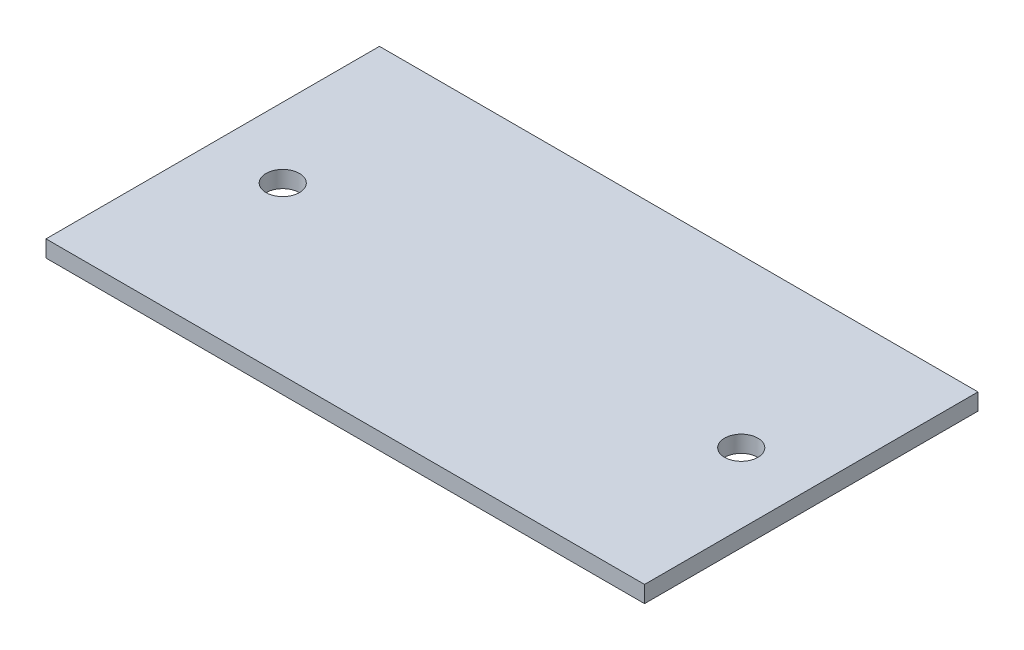
from build123d import *

# Parameters (mm, degrees)
ESBO_O1_W                = 35.9
ESBO_O1_H                = 20
RESSALTO_EXTRUS_O1_DEPTH = 1
CORTE_EXTRUS_O1_REACH    = 22.572
ESBO_O2_R                = 1


with BuildPart() as part:
    # Esboço1 → Ressalto-extrusão1 (new body)
    with BuildSketch(Plane(origin=(0, 0, 0), x_dir=(1, 0, 0), z_dir=(0, 1, 0))):
        Rectangle(ESBO_O1_W, ESBO_O1_H)
    extrude(amount=RESSALTO_EXTRUS_O1_DEPTH)

    # Esboço2 → Corte-extrusão1 (cut, up to next)
    with BuildSketch(Plane(origin=(0, 1, 0), x_dir=(1, 0, 0), z_dir=(0, 1, 0)), mode=Mode.PRIVATE) as corte_extrus_o1_sk1:
        with Locations(Location((13.75, 0, 0), (0, 0, 270))):
            Circle(ESBO_O2_R)
    corte_extrus_o1_tool1 = extrude(corte_extrus_o1_sk1.sketch, amount=-CORTE_EXTRUS_O1_REACH, mode=Mode.PRIVATE) & part.part
    # Esboço2 → Corte-extrusão1 (cut, up to next)
    with BuildSketch(Plane(origin=(0, 1, 0), x_dir=(1, 0, 0), z_dir=(0, 1, 0)), mode=Mode.PRIVATE) as corte_extrus_o1_sk2:
        with Locations(Location((-13.75, 0, 0), (0, 0, 270))):
            Circle(ESBO_O2_R)
    corte_extrus_o1_tool2 = extrude(corte_extrus_o1_sk2.sketch, amount=-CORTE_EXTRUS_O1_REACH, mode=Mode.PRIVATE) & part.part
    add(corte_extrus_o1_tool1.solids().sort_by_distance((13.75, 1, 0))[0], mode=Mode.SUBTRACT)
    add(corte_extrus_o1_tool2.solids().sort_by_distance((-13.75, 1, 0))[0], mode=Mode.SUBTRACT)


solid = part.part
